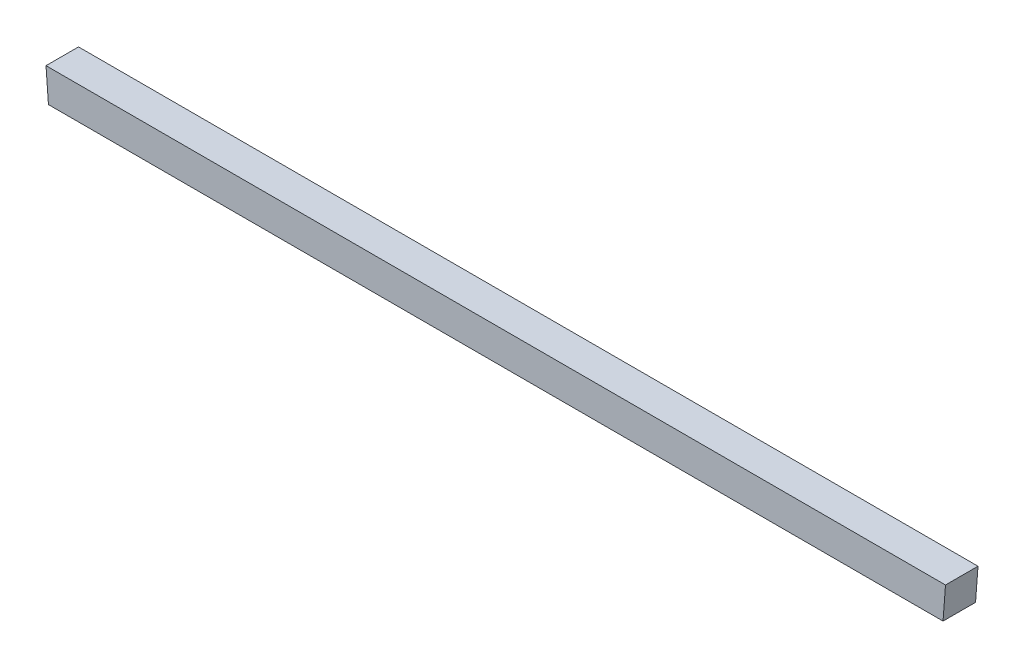
from build123d import *

# Parameters (mm, degrees)
BOSS_EXTRUDE1_DEPTH      = 150
BOSS_EXTRUDE1_DEPTH_BACK = 150


with BuildPart() as part:
    # Sketch1 → Boss-Extrude1 (new, two sides: drawn at the far end of the back side and taken through both)
    with BuildSketch(Plane.XY.offset(-BOSS_EXTRUDE1_DEPTH_BACK)):
        Polygon((-4150, 150), (-4127.5, -150), (4127.5, -150), (4150, 150), align=None)
    extrude(amount=BOSS_EXTRUDE1_DEPTH + BOSS_EXTRUDE1_DEPTH_BACK)


solid = part.part
